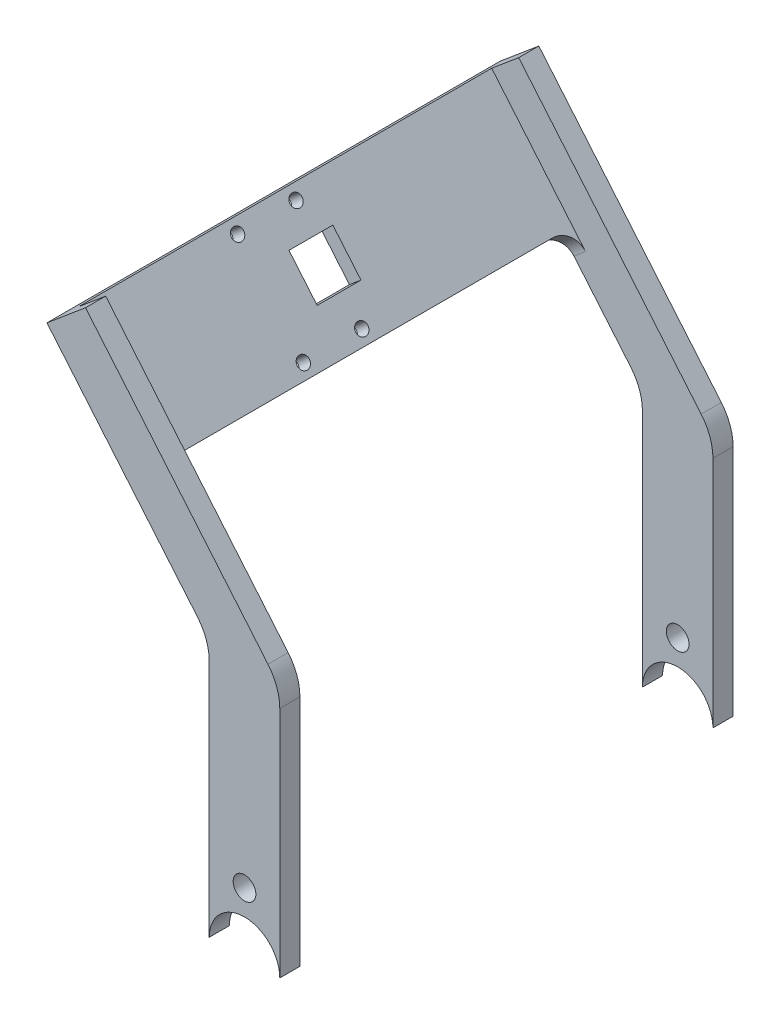
from build123d import *

# Parameters (mm, degrees)
ESTRUSIONE_ESTRUSIONE1_DEPTH = 4
ESTRUSIONE_ESTRUSIONE2_DEPTH = 82
ESTRUSIONE_ESTRUSIONE3_START = 4
ESTRUSIONE_ESTRUSIONE3_DEPTH = 4
FORO_PER_VITE_M4_1_D         = 4.5
FORO_PER_VITE_M4_1_DEPTH     = 188
FORO_PER_VITE_M4_1_TIP       = 1.351936393
SCHIZZO6_R                   = 1.2
SCHIZZO6_W                   = 8.7
SCHIZZO6_H                   = 8.7
TAGLIO_ESTRUSIONE1_DEPTH     = 10
RACCORDO1_R                  = 10
RACCORDO2_R                  = 4


with BuildPart() as part:
    # Schizzo1 → Estrusione-Estrusione1 (new body)
    with BuildSketch(Plane.XY):
        with BuildLine():
            Line((-7, 0), (-7, 51.127312028))
            Line((-7, 51.127312028), (-39.227701012, 89.53479049))
            Line((-39.227701012, 89.53479049), (-31.567256581, 95.962666587))
            Line((-31.567256581, 95.962666587), (7, 50))
            Line((7, 50), (7, 0))
            ThreePointArc((7, 0), (0, 7), (-7, 0))
        make_face()
    extrude(amount=ESTRUSIONE_ESTRUSIONE1_DEPTH)

    # Schizzo4 → Estrusione-Estrusione2 (add)
    with BuildSketch(Plane.XY):
        Polygon((-39.227701012, 89.53479049), (-23.15801077, 70.383679412), (-20.859877441, 72.312042241), (-36.929567683, 91.463153319), align=None)
    extrude(amount=-ESTRUSIONE_ESTRUSIONE2_DEPTH)

    # Schizzo5 → Estrusione-Estrusione3 (add)
    with BuildSketch(Plane(origin=(0, 0, -82), x_dir=(-1, 0, 0), z_dir=(0, 0, -1)).offset(ESTRUSIONE_ESTRUSIONE3_START)):
        with BuildLine():
            Line((-7, 0), (-7, 50))
            Line((-7, 50), (31.567256581, 95.962666587))
            Line((31.567256581, 95.962666587), (39.227701012, 89.53479049))
            Line((39.227701012, 89.53479049), (7, 51.127312028))
            Line((7, 51.127312028), (7, 0))
            ThreePointArc((7, 0), (0, 7), (-7, 0))
        make_face()
    extrude(amount=-ESTRUSIONE_ESTRUSIONE3_DEPTH)

    # Foro per Vite M4-1
    with Locations(Plane.XY.offset(4)):
        with Locations((0, 12)):
            Hole(FORO_PER_VITE_M4_1_D / 2, depth=FORO_PER_VITE_M4_1_DEPTH)
            with Locations((0, 0, -(FORO_PER_VITE_M4_1_DEPTH + FORO_PER_VITE_M4_1_TIP / 2))):  # 118° drill point
                Cone(0, FORO_PER_VITE_M4_1_D / 2, FORO_PER_VITE_M4_1_TIP, mode=Mode.SUBTRACT)

    # Schizzo6 → Taglio-Estrusione1 (cut)
    with BuildSketch(Plane(origin=(23.365651345, 19.606109426, 0), x_dir=(0, 0, -1), z_dir=(0.7660444431189758, 0.642787609686542, 0))):
        with Locations(Location((30.05, 91.452708888, 0), (0, 0, 90))):
            Circle(SCHIZZO6_R)
        with Locations(Location((41.65, 91.452708888, 0), (0, 0, 90))):
            Circle(SCHIZZO6_R)
        with Locations(Location((30.05, 71.152708888, 0), (0, 0, 90))):
            Circle(SCHIZZO6_R)
        with Locations(Location((41.65, 71.152708888, 0), (0, 0, 90))):
            Circle(SCHIZZO6_R)
        with Locations((41, 81.502708888)):
            Rectangle(SCHIZZO6_W, SCHIZZO6_H)
    extrude(amount=-TAGLIO_ESTRUSIONE1_DEPTH, mode=Mode.SUBTRACT)

    # Raccordo1
    raccordo1_edges = [part.edges().sort_by_distance(p)[0] for p in [
        (-7, 51.127312028, 2),
        (7, 50, 2),
        (-7, 51.127312028, -84),
        (7, 50, -84),
    ]]
    fillet(raccordo1_edges, radius=RACCORDO1_R)

    # Raccordo2
    raccordo2_edges = [part.edges().sort_by_distance(p)[0] for p in [
        (-22.008944106, 71.347860827, -82),
        (-22.008944106, 71.347860827, 0),
    ]]
    fillet(raccordo2_edges, radius=RACCORDO2_R)


solid = part.part
